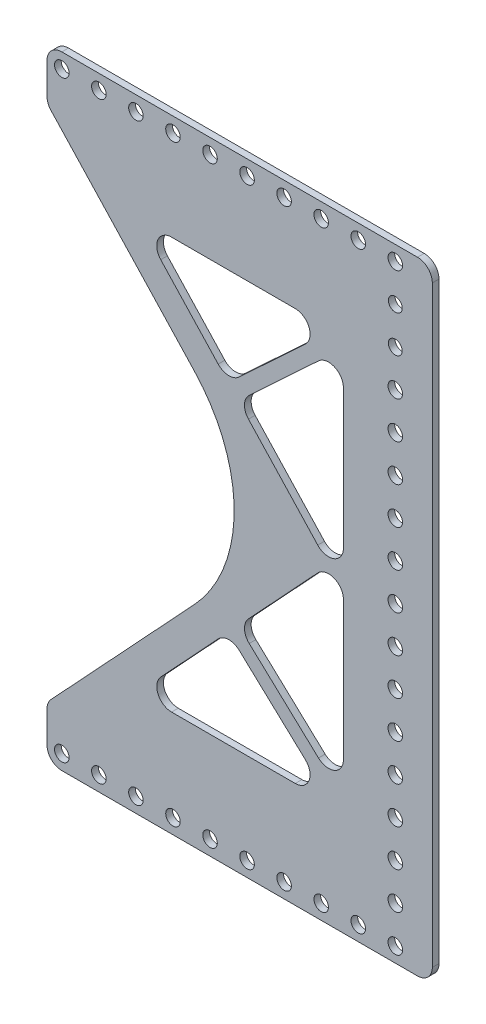
from build123d import *

# Parameters (mm, degrees)
SKETCH1_R           = 2.4892
SKETCH1_R_2         = 2.37186857
BOSS_EXTRUDE1_DEPTH = 2.286
CUT_EXTRUDE1_DEPTH  = 819.47149982
FILLET1_R           = 5.08


with BuildPart() as part:
    # Sketch1 → Boss-Extrude1 (new body)
    with BuildSketch(Plane.XY):
        with BuildLine():
            Line((238.806714439, 781.287169191), (222.296714439, 781.287169191))
            Line((222.296714439, 781.287169191), (176.576714439, 781.287169191))
            Line((176.576714439, 781.287169191), (116.886714439, 781.287169191))
            ThreePointArc((116.886714439, 781.287169191), (113.29461199, 779.799271639), (111.806714439, 776.207169191))
            Line((111.806714439, 776.207169191), (111.806714439, 757.885949725))
            ThreePointArc((111.806714439, 757.885949725), (112.159468576, 756.025964093), (113.16874064, 754.424292487))
            Line((113.16874064, 754.424292487), (162.347850631, 701.603741569))
            ThreePointArc((162.347850631, 701.603741569), (175.968112644, 666.987169191), (162.347850631, 632.370596813))
            Line((162.347850631, 632.370596813), (113.16874064, 579.550045895))
            ThreePointArc((113.16874064, 579.550045895), (112.159468576, 577.948374289), (111.806714439, 576.088388657))
            Line((111.806714439, 576.088388657), (111.806714439, 557.767169191))
            ThreePointArc((111.806714439, 557.767169191), (113.29461199, 554.175066742), (116.886714439, 552.687169191))
            Line((116.886714439, 552.687169191), (176.576714439, 552.687169191))
            Line((176.576714439, 552.687169191), (222.296714439, 552.687169191))
            Line((222.296714439, 552.687169191), (238.806714439, 552.687169191))
            ThreePointArc((238.806714439, 552.687169191), (242.398816887, 554.175066742), (243.886714439, 557.767169191))
            Line((243.886714439, 557.767169191), (243.886714439, 666.987169191))
            Line((243.886714439, 666.987169191), (243.886714439, 776.207169191))
            ThreePointArc((243.886714439, 776.207169191), (242.398816887, 779.799271639), (238.806714439, 781.287169191))
        make_face()
        with Locations((142.286714439, 768.587169191)):
            Circle(SKETCH1_R, mode=Mode.SUBTRACT)
        with Locations((154.986714439, 768.587169191)):
            Circle(SKETCH1_R, mode=Mode.SUBTRACT)
        with Locations((167.686714439, 768.587169191)):
            Circle(SKETCH1_R, mode=Mode.SUBTRACT)
        with Locations((231.186714439, 743.187169191)):
            Circle(SKETCH1_R_2, mode=Mode.SUBTRACT)
        with Locations((231.186714439, 730.487169191)):
            Circle(SKETCH1_R, mode=Mode.SUBTRACT)
        with Locations((231.186714439, 717.787169191)):
            Circle(SKETCH1_R, mode=Mode.SUBTRACT)
        with Locations((231.186714439, 705.087169191)):
            Circle(SKETCH1_R, mode=Mode.SUBTRACT)
        with Locations((231.186714439, 692.387169191)):
            Circle(SKETCH1_R, mode=Mode.SUBTRACT)
        with Locations(Location((167.686714439, 565.387169191, 0), (0, 0, 180))):
            Circle(SKETCH1_R, mode=Mode.SUBTRACT)
        with Locations(Location((154.986714439, 565.387169191, 0), (0, 0, 180))):
            Circle(SKETCH1_R, mode=Mode.SUBTRACT)
        with Locations(Location((142.286714439, 565.387169191, 0), (0, 0, 180))):
            Circle(SKETCH1_R, mode=Mode.SUBTRACT)
        with Locations((231.186714439, 616.187169191)):
            Circle(SKETCH1_R, mode=Mode.SUBTRACT)
        with Locations((231.186714439, 603.487169191)):
            Circle(SKETCH1_R, mode=Mode.SUBTRACT)
        with Locations((231.186714439, 590.787169191)):
            Circle(SKETCH1_R, mode=Mode.SUBTRACT)
        with Locations((231.186714439, 565.387169191)):
            Circle(SKETCH1_R, mode=Mode.SUBTRACT)
        with Locations(Location((231.186714439, 768.587169191, 0), (0, 0, 180))):
            Circle(SKETCH1_R, mode=Mode.SUBTRACT)
        with Locations((231.186714439, 654.287169191)):
            Circle(SKETCH1_R, mode=Mode.SUBTRACT)
        with Locations((231.186714439, 641.587169191)):
            Circle(SKETCH1_R, mode=Mode.SUBTRACT)
        with Locations((231.186714439, 628.887169191)):
            Circle(SKETCH1_R, mode=Mode.SUBTRACT)
        with Locations((116.886714439, 768.587169191)):
            Circle(SKETCH1_R, mode=Mode.SUBTRACT)
        with Locations((129.586714439, 768.587169191)):
            Circle(SKETCH1_R, mode=Mode.SUBTRACT)
        with Locations((129.586714439, 565.387169191)):
            Circle(SKETCH1_R, mode=Mode.SUBTRACT)
        with Locations((116.886714439, 565.387169191)):
            Circle(SKETCH1_R, mode=Mode.SUBTRACT)
        with Locations((231.186714439, 679.687169191)):
            Circle(SKETCH1_R, mode=Mode.SUBTRACT)
        with Locations((231.186714439, 666.987169191)):
            Circle(SKETCH1_R, mode=Mode.SUBTRACT)
        with Locations((231.186714439, 755.887169191)):
            Circle(SKETCH1_R_2, mode=Mode.SUBTRACT)
        with Locations((231.186714439, 578.087169191)):
            Circle(SKETCH1_R, mode=Mode.SUBTRACT)
        with Locations(Location((180.386714439, 565.387169191, 0), (0, 0, 180))):
            Circle(SKETCH1_R, mode=Mode.SUBTRACT)
        with Locations(Location((193.086714439, 565.387169191, 0), (0, 0, 180))):
            Circle(SKETCH1_R, mode=Mode.SUBTRACT)
        with Locations(Location((205.786714439, 565.387169191, 0), (0, 0, 180))):
            Circle(SKETCH1_R, mode=Mode.SUBTRACT)
        with Locations(Location((218.486714439, 565.387169191, 0), (0, 0, 180))):
            Circle(SKETCH1_R, mode=Mode.SUBTRACT)
        with Locations((180.386714439, 768.587169191)):
            Circle(SKETCH1_R, mode=Mode.SUBTRACT)
        with Locations((193.086714439, 768.587169191)):
            Circle(SKETCH1_R, mode=Mode.SUBTRACT)
        with Locations((205.786714439, 768.587169191)):
            Circle(SKETCH1_R, mode=Mode.SUBTRACT)
        with Locations((218.486714439, 768.587169191)):
            Circle(SKETCH1_R, mode=Mode.SUBTRACT)
        with BuildLine():
            Line((150.786953537, 728.930511953), (170.473797978, 707.785965632))
            ThreePointArc((170.473797978, 707.785965632), (174.010528598, 706.170857078), (177.653429014, 707.529649071))
            Line((177.653429014, 707.529649071), (200.363611972, 728.674195392))
            ThreePointArc((200.363611972, 728.674195392), (201.629200597, 734.252154823), (196.901954734, 737.472169191))
            Line((196.901954734, 737.472169191), (154.504927335, 737.472169191))
            ThreePointArc((154.504927335, 737.472169191), (149.847051276, 734.419628344), (150.786953537, 728.930511953))
        make_face(mode=Mode.SUBTRACT)
        with BuildLine():
            Line((213.406714439, 674.585176614), (213.406714439, 722.206352957))
            ThreePointArc((213.406714439, 722.206352957), (210.354173591, 726.864229016), (204.865057201, 725.924326755))
            Line((204.865057201, 725.924326755), (181.115086252, 703.811675273))
            ThreePointArc((181.115086252, 703.811675273), (179.499977697, 700.274944652), (180.858769691, 696.632044236))
            Line((180.858769691, 696.632044236), (204.60874064, 671.123519376))
            ThreePointArc((204.60874064, 671.123519376), (210.186700071, 669.857930751), (213.406714439, 674.585176614))
        make_face(mode=Mode.SUBTRACT)
        with BuildLine():
            Line((180.858769691, 637.342294146), (204.60874064, 662.850819006))
            ThreePointArc((204.60874064, 662.850819006), (210.186700071, 664.116407631), (213.406714439, 659.389161768))
            Line((213.406714439, 659.389161768), (213.406714439, 611.767985425))
            ThreePointArc((213.406714439, 611.767985425), (210.354173591, 607.110109366), (204.865057201, 608.050011626))
            Line((204.865057201, 608.050011626), (181.115086252, 630.162663109))
            ThreePointArc((181.115086252, 630.162663109), (179.499977697, 633.699393729), (180.858769691, 637.342294146))
        make_face(mode=Mode.SUBTRACT)
        with BuildLine():
            Line((200.363611972, 605.30014299), (177.653429014, 626.44468931))
            ThreePointArc((177.653429014, 626.44468931), (174.010528598, 627.803481304), (170.473797978, 626.188372749))
            Line((170.473797978, 626.188372749), (150.786953537, 605.043826429))
            ThreePointArc((150.786953537, 605.043826429), (149.847051276, 599.554710038), (154.504927335, 596.502169191))
            Line((154.504927335, 596.502169191), (196.901954734, 596.502169191))
            ThreePointArc((196.901954734, 596.502169191), (201.629200597, 599.722183559), (200.363611972, 605.30014299))
        make_face(mode=Mode.SUBTRACT)
    extrude(amount=BOSS_EXTRUDE1_DEPTH)

    # Sketch3 → Cut-Extrude1 (cut, through all)
    with BuildSketch(Plane.XY.offset(2.286)):
        with BuildLine():
            Line((243.886714439, 557.767169191), (243.886714439, 560.307169191))
            Line((243.886714439, 560.307169191), (111.806714439, 560.307169191))
            Line((111.806714439, 560.307169191), (111.806714439, 557.767169191))
            ThreePointArc((111.806714439, 557.767169191), (113.29461199, 554.175066742), (116.886714439, 552.687169191))
            Line((116.886714439, 552.687169191), (238.806714439, 552.687169191))
            ThreePointArc((238.806714439, 552.687169191), (242.398816887, 554.175066742), (243.886714439, 557.767169191))
        make_face()
        with BuildLine():
            Line((111.806714439, 776.207169191), (111.806714439, 773.667169191))
            Line((111.806714439, 773.667169191), (243.886714439, 773.667169191))
            Line((243.886714439, 773.667169191), (243.886714439, 776.207169191))
            ThreePointArc((243.886714439, 776.207169191), (242.398816887, 779.799271639), (238.806714439, 781.287169191))
            Line((238.806714439, 781.287169191), (116.886714439, 781.287169191))
            ThreePointArc((116.886714439, 781.287169191), (113.29461199, 779.799271639), (111.806714439, 776.207169191))
        make_face()
    extrude(amount=-CUT_EXTRUDE1_DEPTH, mode=Mode.SUBTRACT)

    # Fillet1
    fillet1_edges = [part.edges().sort_by_distance(p)[0] for p in [
        (111.806714439, 560.307169191, 1.143),
        (243.886714439, 560.307169191, 1.143),
        (243.886714439, 773.667169191, 1.143),
        (111.806714439, 773.667169191, 1.143),
    ]]
    fillet(fillet1_edges, radius=FILLET1_R)


solid = part.part
